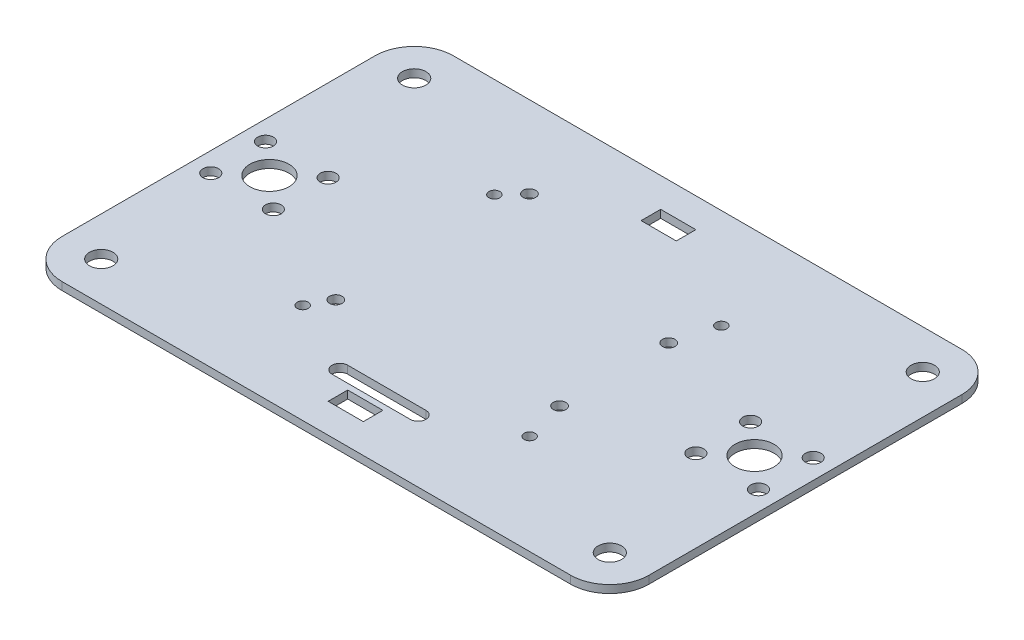
from build123d import *

# Parameters (mm, degrees)
SKETCH1_R           = 1.4
SKETCH1_R_2         = 1.6
SKETCH1_R_3         = 3
SKETCH1_R_4         = 5
SKETCH1_R_5         = 2
SKETCH1_W           = 9
SKETCH1_H           = 5
BOSS_EXTRUDE1_DEPTH = 1


with BuildPart() as part:
    # Sketch1 → Boss-Extrude1 (new, symmetric)
    with BuildSketch(Plane(origin=(0, 0, 0), x_dir=(1, 0, 0), z_dir=(0, 1, 0))):
        with BuildLine():
            Line((-65, -50), (65, -50))
            ThreePointArc((65, -50), (72.071067812, -47.071067812), (75, -40))
            Line((75, -40), (75, 40))
            ThreePointArc((75, 40), (72.071067812, 47.071067812), (65, 50))
            Line((65, 50), (-65, 50))
            ThreePointArc((-65, 50), (-72.071067812, 47.071067812), (-75, 40))
            Line((-75, 40), (-75, -40))
            ThreePointArc((-75, -40), (-72.071067812, -47.071067812), (-65, -50))
        make_face()
        with Locations(Location((-29, 24.5, 0), (0, 0, 270))):
            Circle(SKETCH1_R, mode=Mode.SUBTRACT)
        with Locations(Location((29, 24.5, 0), (0, 0, 270))):
            Circle(SKETCH1_R, mode=Mode.SUBTRACT)
        with Locations(Location((-29, -24.5, 0), (0, 0, 270))):
            Circle(SKETCH1_R, mode=Mode.SUBTRACT)
        with Locations(Location((29, -24.5, 0), (0, 0, 270))):
            Circle(SKETCH1_R, mode=Mode.SUBTRACT)
        with Locations(Location((-24.690715768, 29.15, 0), (0, 0, 270))):
            Circle(SKETCH1_R_2, mode=Mode.SUBTRACT)
        with Locations(Location((-25.990715768, -19.05, 0), (0, 0, 270))):
            Circle(SKETCH1_R_2, mode=Mode.SUBTRACT)
        with Locations(Location((26.109284232, 13.95, 0), (0, 0, 270))):
            Circle(SKETCH1_R_2, mode=Mode.SUBTRACT)
        with Locations(Location((26.109284232, -13.95, 0), (0, 0, 270))):
            Circle(SKETCH1_R_2, mode=Mode.SUBTRACT)
        with Locations(Location((-65, 40, 0), (0, 0, 270))):
            Circle(SKETCH1_R_3, mode=Mode.SUBTRACT)
        with Locations(Location((65, 40, 0), (0, 0, 270))):
            Circle(SKETCH1_R_3, mode=Mode.SUBTRACT)
        with Locations(Location((65, -40, 0), (0, 0, 270))):
            Circle(SKETCH1_R_3, mode=Mode.SUBTRACT)
        with Locations(Location((-65, -40, 0), (0, 0, 270))):
            Circle(SKETCH1_R_3, mode=Mode.SUBTRACT)
        with Locations(Location((-62, 0, 0), (0, 0, 270))):
            Circle(SKETCH1_R_4, mode=Mode.SUBTRACT)
        with Locations(Location((-70, 7, 0), (0, 0, 270))):
            Circle(SKETCH1_R_5, mode=Mode.SUBTRACT)
        with Locations(Location((-54, 7, 0), (0, 0, 270))):
            Circle(SKETCH1_R_5, mode=Mode.SUBTRACT)
        with Locations(Location((-54, -7, 0), (0, 0, 270))):
            Circle(SKETCH1_R_5, mode=Mode.SUBTRACT)
        with Locations(Location((-70, -7, 0), (0, 0, 270))):
            Circle(SKETCH1_R_5, mode=Mode.SUBTRACT)
        with Locations(Location((70, -7, 0), (0, 0, 270))):
            Circle(SKETCH1_R_5, mode=Mode.SUBTRACT)
        with Locations(Location((70, 7, 0), (0, 0, 270))):
            Circle(SKETCH1_R_5, mode=Mode.SUBTRACT)
        with Locations(Location((54, -7, 0), (0, 0, 270))):
            Circle(SKETCH1_R_5, mode=Mode.SUBTRACT)
        with Locations(Location((62, 0, 0), (0, 0, 270))):
            Circle(SKETCH1_R_4, mode=Mode.SUBTRACT)
        with Locations(Location((54, 7, 0), (0, 0, 270))):
            Circle(SKETCH1_R_5, mode=Mode.SUBTRACT)
        with Locations((0, 40)):
            Rectangle(SKETCH1_W, SKETCH1_H, mode=Mode.SUBTRACT)
        with Locations((0, -40)):
            Rectangle(SKETCH1_W, SKETCH1_H, mode=Mode.SUBTRACT)
        with BuildLine():
            Line((-10, -32), (10, -32))
            ThreePointArc((10, -32), (12, -34), (10, -36))
            Line((10, -36), (-10, -36))
            ThreePointArc((-10, -36), (-12, -34), (-10, -32))
        make_face(mode=Mode.SUBTRACT)
    extrude(amount=BOSS_EXTRUDE1_DEPTH, both=True)


solid = part.part
